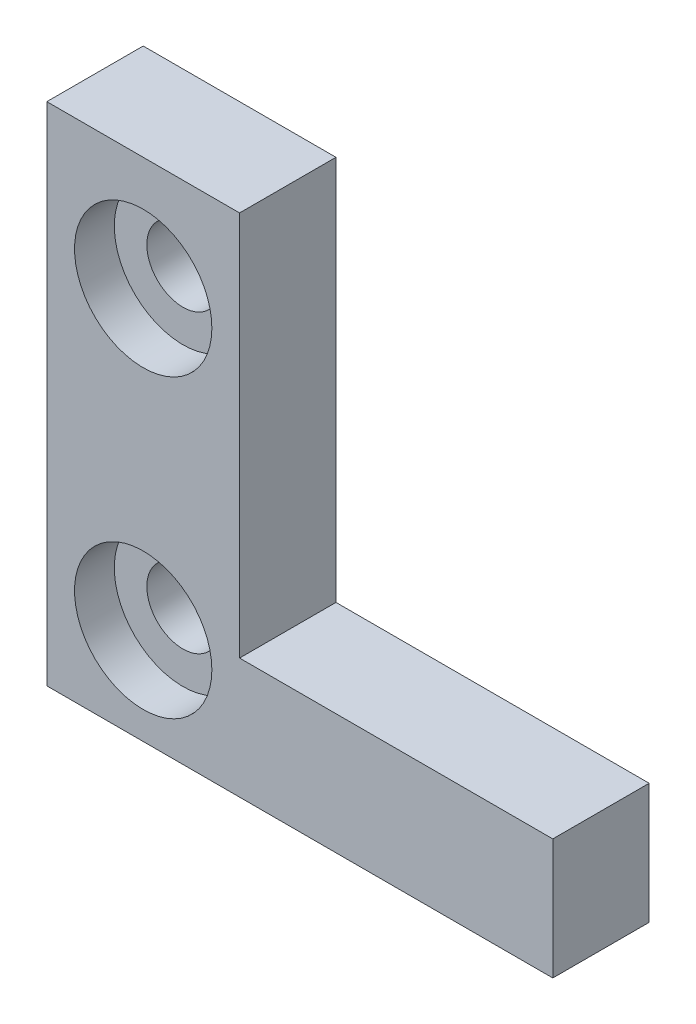
from build123d import *

# Parameters (mm, degrees)
CROQUIS1_W              = 13
CROQUIS1_H              = 8
CROQUIS1_W_2            = 8
CROQUIS1_H_2            = 21
CROQUIS1_R              = 1.5
SALIENTE_EXTRUIR1_DEPTH = 4
CROQUIS2_R              = 2.85
CORTAR_EXTRUIR1_DEPTH   = 1.65
CROQUIS3_W              = 4
CROQUIS3_H              = 3
CORTAR_EXTRUIR2_DEPTH   = 13


with BuildPart() as part:
    # Croquis1 → Saliente-Extruir1 (new body)
    # profile 1 of 2: a face of its own
    with BuildSketch(Plane.XY):
        with Locations((11.5, -79)):
            Rectangle(CROQUIS1_W, CROQUIS1_H)
    # profile 2 of 2: a face of its own
    with BuildSketch(Plane.XY):
        with Locations((1, -72.5)):
            Rectangle(CROQUIS1_W_2, CROQUIS1_H_2)
        with Locations((1, -66.715045403)):
            Circle(CROQUIS1_R, mode=Mode.SUBTRACT)
        with Locations((1, -79)):
            Circle(CROQUIS1_R, mode=Mode.SUBTRACT)
    extrude(amount=SALIENTE_EXTRUIR1_DEPTH)

    # Croquis2 → Cortar-Extruir1 (cut)
    with BuildSketch(Plane.XY.offset(4)):
        with Locations((1, -79)):
            Circle(CROQUIS2_R)
        with Locations((1, -66.715045403)):
            Circle(CROQUIS2_R)
    extrude(amount=-CORTAR_EXTRUIR1_DEPTH, mode=Mode.SUBTRACT)

    # Croquis3 → Cortar-Extruir2 (cut)
    with BuildSketch(Plane(origin=(18, 0, 0), x_dir=(0, 0, -1), z_dir=(1, 0, 0))):
        with Locations((-2, -76.5)):
            Rectangle(CROQUIS3_W, CROQUIS3_H)
    extrude(amount=-CORTAR_EXTRUIR2_DEPTH, mode=Mode.SUBTRACT)


solid = part.part
